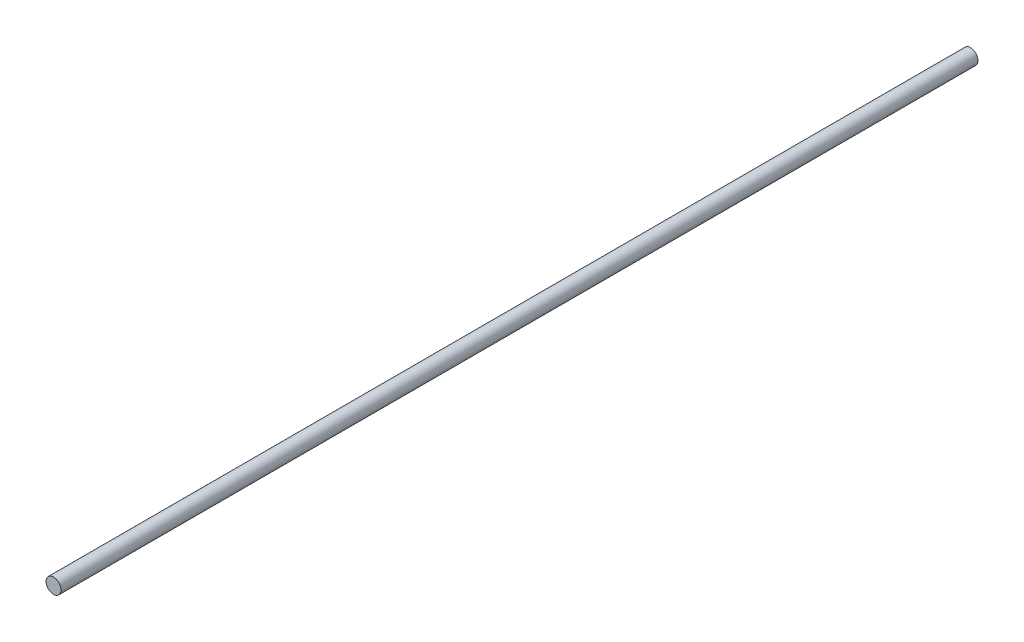
from build123d import *

# Parameters (mm, degrees)
SKETCH1_R           = 6.0325
BOSS_EXTRUDE1_DEPTH = 736.6


with BuildPart() as part:
    # Sketch1 → Boss-Extrude1 (new body)
    with BuildSketch(Plane.XY):
        Circle(SKETCH1_R)
    extrude(amount=BOSS_EXTRUDE1_DEPTH)


solid = part.part
